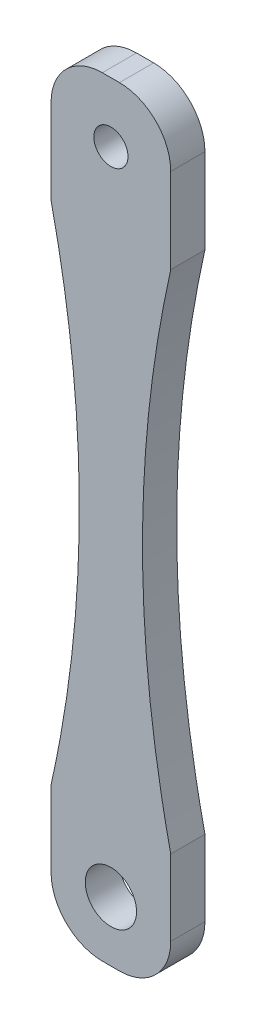
from build123d import *

# Parameters (mm, degrees)
SKETCH1_R           = 1
SKETCH1_R_2         = 1.5
BOSS_EXTRUDE1_DEPTH = 2
CUT_EXTRUDE1_DEPTH  = 14


with BuildPart() as part:
    # Sketch1 → Boss-Extrude1 (new body)
    with BuildSketch(Plane.XY):
        with BuildLine():
            Line((-0.5, 22.5), (0.5, 22.5))
            ThreePointArc((0.5, 22.5), (2.621320344, 21.621320344), (3.5, 19.5))
            Line((3.5, 19.5), (3.5, -19.5))
            ThreePointArc((3.5, -19.5), (2.621320344, -21.621320344), (0.5, -22.5))
            Line((0.5, -22.5), (-0.5, -22.5))
            ThreePointArc((-0.5, -22.5), (-2.621320344, -21.621320344), (-3.5, -19.5))
            Line((-3.5, -19.5), (-3.5, 19.5))
            ThreePointArc((-3.5, 19.5), (-2.621320344, 21.621320344), (-0.5, 22.5))
        make_face()
        with Locations((0, 19)):
            Circle(SKETCH1_R, mode=Mode.SUBTRACT)
        with Locations((0, -19)):
            Circle(SKETCH1_R_2, mode=Mode.SUBTRACT)
    extrude(amount=BOSS_EXTRUDE1_DEPTH)

    # Sketch2 → Cut-Extrude1 (cut)
    with BuildSketch(Plane.XY.offset(2)):
        with BuildLine():
            Line((-3.5, 14.530463873), (-3.5, -15.069881222))
            add(Edge.make_bspline(
                [(-3.5, 14.530463873), (-0.195046467, -0.263066887), (-3.5, -15.069881222)],
                knots=[0, 0, 0, 1, 1, 1], degree=2))
        make_face()
        with BuildLine():
            add(Edge.make_bspline(
                [(3.5, 14.530463873), (0.195046467, -0.263066887), (3.5, -15.069881222)],
                knots=[0, 0, 0, 1, 1, 1], degree=2))
            Line((3.5, -15.069881222), (3.5, 14.530463873))
        make_face()
    extrude(amount=-CUT_EXTRUDE1_DEPTH, mode=Mode.SUBTRACT)


solid = part.part
